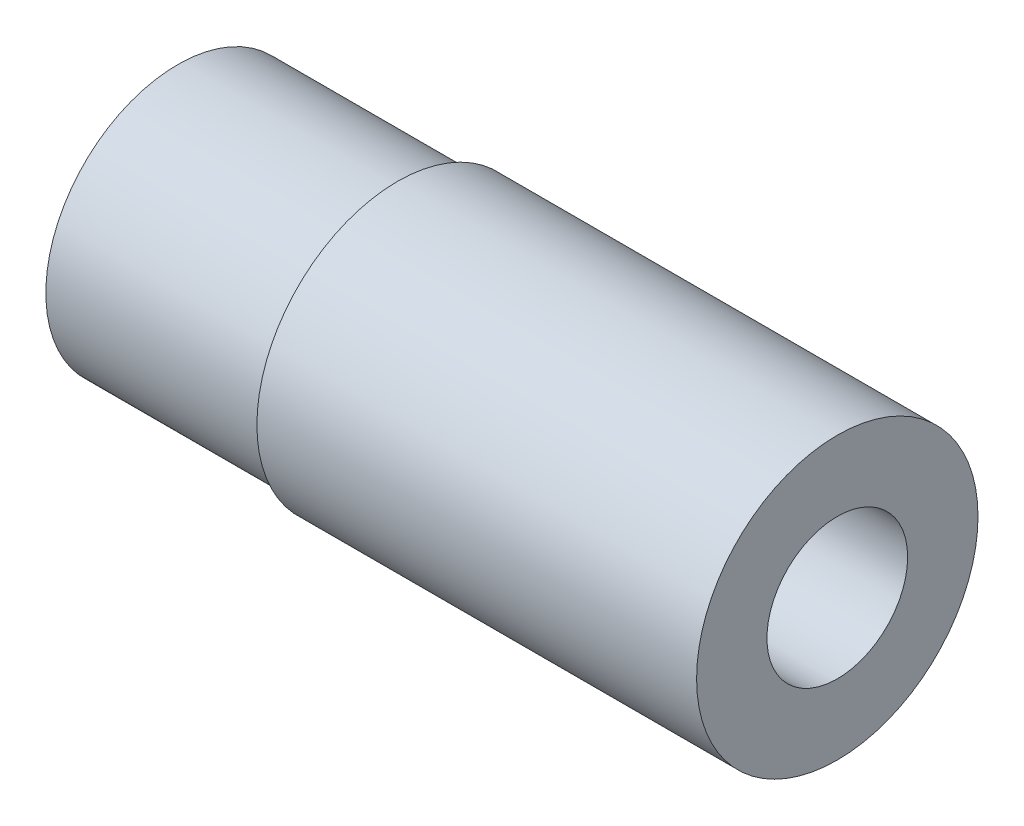
from build123d import *

# Parameters (mm, degrees)
SKETCH_1_R      = 15
SKETCH_1_R_2    = 12
EXTRUDE_1_DEPTH = 25
SKETCH_2_R      = 16
SKETCH_2_R_2    = 8
EXTRUDE_2_DEPTH = 50


with BuildPart() as part:
    # 草图1 → 凸台-拉伸1 (new body)
    with BuildSketch(Plane(origin=(0, 0, 0), x_dir=(0, 0, -1), z_dir=(1, 0, 0))):
        Circle(SKETCH_1_R)
        Circle(SKETCH_1_R_2, mode=Mode.SUBTRACT)
    extrude(amount=EXTRUDE_1_DEPTH)

    # 草图2 → 凸台-拉伸2 (add)
    with BuildSketch(Plane(origin=(25, 0, 0), x_dir=(0, 0, -1), z_dir=(1, 0, 0))):
        Circle(SKETCH_2_R)
        Circle(SKETCH_2_R_2, mode=Mode.SUBTRACT)
    extrude(amount=EXTRUDE_2_DEPTH)


solid = part.part
